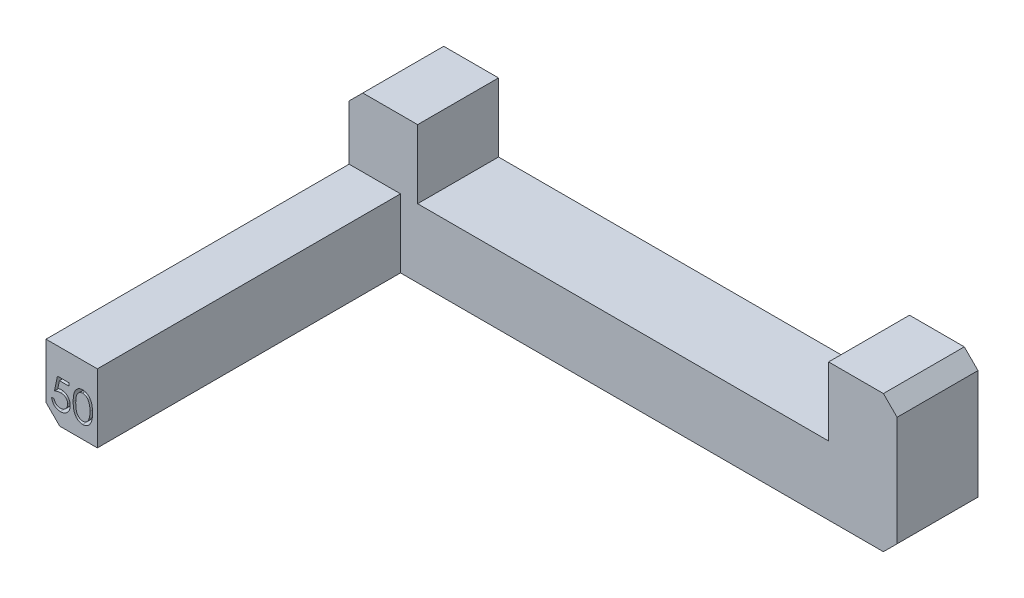
from build123d import *

# Parameters (mm, degrees)
BOSS_EXTRUDE1_DEPTH = 15
SKETCH2_W           = 9.525
SKETCH2_H           = 12.7
BOSS_EXTRUDE2_DEPTH = 56.2
CUT_EXTRUDE1_DEPTH  = 2
CHAMFER1_SIZE       = 2.54


with BuildPart() as part:
    # Sketch1 → Boss-Extrude1 (new body)
    with BuildSketch(Plane.XY):
        Polygon((-101.6, 0), (0, 0), (0, 25.4), (-12.7, 25.4), (-12.7, 12.7), (-88.9, 12.7), (-88.9, 25.4), (-101.6, 25.4), align=None)
    extrude(amount=BOSS_EXTRUDE1_DEPTH)

    # Sketch2 → Boss-Extrude2 (add)
    with BuildSketch(Plane.XY.offset(15)):
        with Locations((-96.8375, 6.35)):
            Rectangle(SKETCH2_W, SKETCH2_H)
    extrude(amount=BOSS_EXTRUDE2_DEPTH)

    # Sketch3 → Cut-Extrude1 (cut)
    # profile 1 of 2: a face of its own
    with BuildSketch(Plane.XY.offset(71.2)):
        with BuildLine():
            Line((-97.310222222, 7.831666667), (-97.310222222, 7.288931624))
            Line((-97.310222222, 7.288931624), (-99.11015211, 7.288931624))
            Line((-99.11015211, 7.288931624), (-99.395300013, 5.897113048))
            add(Edge.make_bspline(
                [(-99.395300013, 5.897113048), (-99.33927506, 5.912580244), (-99.230735575, 5.942545491), (-99.070534357, 5.975816121), (-98.918448525, 5.995872209), (-98.819758382, 5.998610738), (-98.772002738, 5.999935897)],
                knots=[0, 0, 0, 0, 1.100273476, 2.13160584, 3.095893838, 4, 4, 4, 4], degree=3))
            add(Edge.make_bspline(
                [(-98.772002738, 5.999935897), (-98.712911846, 5.998656923), (-98.596724388, 5.99614214), (-98.426727408, 5.971994225), (-98.264450296, 5.933985069), (-98.110232427, 5.880886184), (-97.963788499, 5.812986945), (-97.826465876, 5.728169178), (-97.696203317, 5.629089023), (-97.575337729, 5.51517454), (-97.465687882, 5.389804953), (-97.369279779, 5.255006743), (-97.2873911, 5.112089921), (-97.221531388, 4.959689), (-97.168940787, 4.799488852), (-97.133937176, 4.629803876), (-97.11062858, 4.452233504), (-97.108024496, 4.330820642), (-97.106696581, 4.268907919)],
                knots=[0, 0, 0, 0, 1.052922333, 2.070308379, 3.05430497, 4.020497103, 4.973039431, 5.925935799, 6.892292201, 7.88610001, 8.88166317, 9.857072816, 10.836096531, 11.812156883, 12.81219415, 13.836441305, 14.89672472, 16, 16, 16, 16], degree=3))
            add(Edge.make_bspline(
                [(-97.106696581, 4.268907919), (-97.107702112, 4.225785039), (-97.109699584, 4.140122045), (-97.119857448, 4.012904028), (-97.139415019, 3.888379268), (-97.165673364, 3.766531247), (-97.199755353, 3.647590649), (-97.241013804, 3.531217029), (-97.291505417, 3.418134707), (-97.346888567, 3.307273693), (-97.409249314, 3.201140236), (-97.478462057, 3.101885221), (-97.551586073, 3.0080197), (-97.630267692, 2.920550365), (-97.715238244, 2.840051993), (-97.80546867, 2.766046853), (-97.900238972, 2.697283413), (-98.00101535, 2.636552928), (-98.105552199, 2.580668458), (-98.215359146, 2.534822158), (-98.327936634, 2.493833621), (-98.444904958, 2.461162074), (-98.565999175, 2.435561664), (-98.691418895, 2.418173851), (-98.820506336, 2.405509475), (-98.908007843, 2.404716697), (-98.952207732, 2.404316239)],
                knots=[0, 0, 0, 0, 1.056347294, 2.098418968, 3.122841568, 4.141288669, 5.149314143, 6.15115421, 7.162517403, 8.180376062, 9.185164535, 10.17417709, 11.141909838, 12.097768115, 13.052685741, 14.0056014, 14.954263652, 15.917497458, 16.885230207, 17.854509472, 18.828990115, 19.81800267, 20.826176721, 21.857883937, 22.917946725, 24, 24, 24, 24], degree=3))
            add(Edge.make_bspline(
                [(-98.952207732, 2.404316239), (-99.004934172, 2.405360721), (-99.108667214, 2.407415614), (-99.260644738, 2.42891261), (-99.406868011, 2.459700912), (-99.546159949, 2.506020034), (-99.679768884, 2.564057968), (-99.805896088, 2.637409798), (-99.927764345, 2.720532967), (-100.040419448, 2.818625882), (-100.144976905, 2.925843639), (-100.238573651, 3.042196263), (-100.321930368, 3.165763396), (-100.3937122, 3.297145129), (-100.454941351, 3.435996241), (-100.503042583, 3.582836969), (-100.54186581, 3.73690007), (-100.558290268, 3.842965496), (-100.566632479, 3.896837607)],
                knots=[0, 0, 0, 0, 1.0467383, 2.05933395, 3.04377827, 4.011590433, 4.970194871, 5.932262533, 6.905835911, 7.896367577, 8.894135286, 9.877477877, 10.858688626, 11.851381753, 12.8477658, 13.868841284, 14.917554742, 16, 16, 16, 16], degree=3))
            Line((-100.566632479, 3.896837607), (-100.091739316, 3.896837607))
            add(Edge.make_bspline(
                [(-100.091739316, 3.896837607), (-100.080054474, 3.846375589), (-100.057595557, 3.74938479), (-100.00829877, 3.613114786), (-99.948025363, 3.491679769), (-99.876354503, 3.383473375), (-99.790856243, 3.289116915), (-99.693293892, 3.205029214), (-99.583911025, 3.129169197), (-99.462364118, 3.065937157), (-99.33413482, 3.012009398), (-99.199927252, 2.976099098), (-99.063395681, 2.950848938), (-98.971051002, 2.948321395), (-98.924646968, 2.947051282)],
                knots=[0, 0, 0, 0, 1.136247022, 2.183929868, 3.172523383, 4.106158343, 5.02341133, 5.958108904, 6.928429099, 7.938127109, 8.96079061, 9.975095812, 10.982467395, 12, 12, 12, 12], degree=3))
            add(Edge.make_bspline(
                [(-98.924646968, 2.947051282), (-98.879352654, 2.94829222), (-98.790167777, 2.950735637), (-98.658917228, 2.969542239), (-98.532200145, 2.998506662), (-98.411266879, 3.041852752), (-98.294001218, 3.094534648), (-98.183369446, 3.162139584), (-98.076171049, 3.239942231), (-97.975738037, 3.329079041), (-97.883754584, 3.427307031), (-97.802480449, 3.532350233), (-97.73478202, 3.644407847), (-97.677731641, 3.761539875), (-97.634410582, 3.885030075), (-97.603505765, 4.014299709), (-97.585358284, 4.149668072), (-97.582861857, 4.241999052), (-97.581589744, 4.289048478)],
                knots=[0, 0, 0, 0, 1.027316725, 2.022795036, 3.002884548, 3.971462791, 4.93288096, 5.914575861, 6.907176829, 7.935150275, 8.956128384, 9.956726525, 10.942570165, 11.921478529, 12.907843606, 13.90538589, 14.932640048, 16, 16, 16, 16], degree=3))
            add(Edge.make_bspline(
                [(-97.581589744, 4.289048478), (-97.582585302, 4.33149634), (-97.584533965, 4.414581991), (-97.600455185, 4.536137935), (-97.628148703, 4.651153129), (-97.666587188, 4.760182983), (-97.715390729, 4.863330331), (-97.775029797, 4.960701624), (-97.846623624, 5.051013491), (-97.928405408, 5.134308185), (-98.017997923, 5.211180793), (-98.116942629, 5.276712924), (-98.223168947, 5.331842895), (-98.335397032, 5.379419511), (-98.456296342, 5.413589686), (-98.58347268, 5.439243513), (-98.718299369, 5.454083406), (-98.810481243, 5.456142452), (-98.857865118, 5.457200855)],
                knots=[0, 0, 0, 0, 1.045622112, 2.046656509, 3.013763289, 3.955457236, 4.890082067, 5.820317437, 6.762574623, 7.722996705, 8.69280354, 9.665887285, 10.63943826, 11.638615906, 12.663482002, 13.728887084, 14.832589034, 16, 16, 16, 16], degree=3))
            add(Edge.make_bspline(
                [(-98.857865118, 5.457200855), (-98.898881474, 5.456323056), (-98.983569845, 5.454510625), (-99.113476976, 5.441165802), (-99.249989462, 5.419637345), (-99.392583996, 5.390024804), (-99.541688812, 5.351273057), (-99.696989252, 5.304835658), (-99.858811845, 5.249315493), (-99.967846976, 5.207387027), (-100.023897436, 5.185833333)],
                knots=[0, 0, 0, 0, 0.817624296, 1.688186739, 2.600797293, 3.572016777, 4.590301741, 5.671205678, 6.80286297, 8, 8, 8, 8], degree=3))
            Line((-100.023897436, 5.185833333), (-99.481162393, 7.831666667))
            Line((-99.481162393, 7.831666667), (-97.310222222, 7.831666667))
        make_face()
    # profile 2 of 2: a face of its own
    with BuildSketch(Plane.XY.offset(71.2)):
        with BuildLine():
            add(Edge.make_bspline(
                [(-96.563961538, 5.183713275), (-96.563465606, 5.268527182), (-96.562502251, 5.43327942), (-96.551785233, 5.673346677), (-96.533982037, 5.898560447), (-96.509583866, 6.108931511), (-96.479893111, 6.304514179), (-96.440257792, 6.484785776), (-96.395183673, 6.650580657), (-96.342943666, 6.802439469), (-96.283997842, 6.942408139), (-96.219841281, 7.073074812), (-96.147927842, 7.194241781), (-96.072367509, 7.307842965), (-95.990101639, 7.412018789), (-95.903471325, 7.508240433), (-95.809095393, 7.594284068), (-95.710182035, 7.672670739), (-95.605835714, 7.741386012), (-95.499030731, 7.8019117), (-95.38903194, 7.853618642), (-95.27553902, 7.89427442), (-95.159572058, 7.927855105), (-95.040725659, 7.950819348), (-94.918803597, 7.965268483), (-94.836508452, 7.966649862), (-94.794772503, 7.967350427)],
                knots=[0, 0, 0, 0, 1.646270934, 3.197905019, 4.663502075, 6.030701355, 7.308322542, 8.50163776, 9.611534131, 10.641858119, 11.616356847, 12.558055219, 13.465016945, 14.349605745, 15.204443733, 16.039544428, 16.859896111, 17.680448484, 18.487036065, 19.28249412, 20.06191084, 20.843045899, 21.620316918, 22.403196591, 23.190181807, 24, 24, 24, 24], degree=3))
            add(Edge.make_bspline(
                [(-94.794772503, 7.967350427), (-94.75268791, 7.966612897), (-94.668994897, 7.965146182), (-94.545260044, 7.951049269), (-94.424383739, 7.927658404), (-94.306881315, 7.894515978), (-94.191787586, 7.853398705), (-94.080002779, 7.801862231), (-93.970832548, 7.741871562), (-93.866011756, 7.6713807), (-93.764389659, 7.592788449), (-93.668462382, 7.50394489), (-93.578221193, 7.4057471), (-93.492533529, 7.299245711), (-93.413830423, 7.182398023), (-93.338880115, 7.057236333), (-93.271793823, 6.921571812), (-93.207183064, 6.777668009), (-93.151413453, 6.621543192), (-93.101118058, 6.454077423), (-93.060479618, 6.27329264), (-93.02662917, 6.080137365), (-93.000405339, 5.873902241), (-92.981305988, 5.655029359), (-92.971216919, 5.423374721), (-92.969316906, 5.26499083), (-92.96834188, 5.183713275)],
                knots=[0, 0, 0, 0, 0.810914788, 1.612654377, 2.396697861, 3.181598691, 3.963628158, 4.749916497, 5.551656086, 6.361998678, 7.18212741, 8.025565596, 8.878627764, 9.750805457, 10.657531673, 11.591944965, 12.560506719, 13.57287815, 14.630710178, 15.753379473, 16.941251878, 18.199788006, 19.531962791, 20.947069417, 22.433333509, 24, 24, 24, 24], degree=3))
            add(Edge.make_bspline(
                [(-92.96834188, 5.183713275), (-92.969327014, 5.102790223), (-92.971246507, 4.945114958), (-92.981192885, 4.71450265), (-93.000785101, 4.496791323), (-93.02529306, 4.291458838), (-93.059236778, 4.099359819), (-93.10097316, 3.919829522), (-93.147313529, 3.752092651), (-93.204516134, 3.597523353), (-93.267125185, 3.453965391), (-93.33524435, 3.319909107), (-93.40822373, 3.194169593), (-93.487732904, 3.077753309), (-93.572480326, 2.969835578), (-93.664279841, 2.872321315), (-93.760543701, 2.782860894), (-93.862464854, 2.703256648), (-93.968920413, 2.633580812), (-94.077715684, 2.571269396), (-94.190781038, 2.521024726), (-94.305554193, 2.477882461), (-94.423676841, 2.444922254), (-94.545001742, 2.42213202), (-94.668911765, 2.406148392), (-94.752673655, 2.404929072), (-94.794772503, 2.404316239)],
                knots=[0, 0, 0, 0, 1.561518951, 3.042555995, 4.452378317, 5.7783523, 7.031515105, 8.214008947, 9.334062868, 10.386615937, 11.391082383, 12.354592575, 13.286541444, 14.194233754, 15.072674879, 15.931287219, 16.775624067, 17.606195743, 18.42308326, 19.229000347, 20.022332153, 20.807536673, 21.593273796, 22.3848459, 23.188221202, 24, 24, 24, 24], degree=3))
            add(Edge.make_bspline(
                [(-94.794772503, 2.404316239), (-94.836507294, 2.405021324), (-94.918800156, 2.406411614), (-95.040738943, 2.42079547), (-95.159094542, 2.443920815), (-95.274450991, 2.47630068), (-95.387400127, 2.515935016), (-95.496402846, 2.567572133), (-95.60267113, 2.627041499), (-95.705921459, 2.69476791), (-95.804213654, 2.772361407), (-95.898100832, 2.858183606), (-95.985224372, 2.954376144), (-96.066314017, 3.059420147), (-96.143381984, 3.172349216), (-96.21427425, 3.294705208), (-96.279846851, 3.426002965), (-96.339784033, 3.567090758), (-96.392925465, 3.720027375), (-96.439866643, 3.886562443), (-96.476929714, 4.068165845), (-96.508653944, 4.263379007), (-96.534242, 4.473040783), (-96.551711039, 4.697264995), (-96.562508027, 4.935911918), (-96.563468193, 5.099605505), (-96.563961538, 5.183713275)],
                knots=[0, 0, 0, 0, 0.810891512, 1.598919785, 2.382837074, 3.152667961, 3.926044502, 4.706494248, 5.493654104, 6.291793342, 7.103789334, 7.925228297, 8.761435821, 9.622817696, 10.50288917, 11.416980706, 12.369136599, 13.353924996, 14.394355917, 15.514179734, 16.714354668, 17.994756427, 19.357759367, 20.818452758, 22.365282078, 24, 24, 24, 24], degree=3))
        make_face()
        with BuildLine():
            add(Edge.make_bspline(
                [(-96.089068376, 5.185833333), (-96.088887783, 5.115153753), (-96.088537289, 4.977978566), (-96.07938089, 4.778644112), (-96.066907325, 4.592724686), (-96.050818697, 4.419984221), (-96.026926144, 4.261007416), (-96.000155167, 4.114700871), (-95.967576508, 3.981838858), (-95.929030469, 3.861509668), (-95.88512612, 3.751671195), (-95.837189874, 3.649464596), (-95.785693305, 3.553682502), (-95.72806078, 3.465185261), (-95.665293958, 3.383684275), (-95.598810578, 3.307737016), (-95.526129409, 3.240008247), (-95.425582084, 3.158778359), (-95.292842176, 3.074838716), (-95.125594583, 3.001744033), (-94.953738711, 2.955808652), (-94.837093368, 2.949967021), (-94.778872062, 2.947051282)],
                knots=[0, 0, 0, 0, 1.459021318, 2.831673884, 4.118529203, 5.306027144, 6.411944654, 7.436330062, 8.375795394, 9.233974572, 10.042671642, 10.816086306, 11.563610507, 12.285937304, 12.993564865, 13.685989202, 14.367179055, 15.041617293, 16.353048772, 17.594441528, 18.799311195, 20, 20, 20, 20], degree=3))
            add(Edge.make_bspline(
                [(-94.778872062, 2.947051282), (-94.720274154, 2.949466974), (-94.60319932, 2.954293372), (-94.432151796, 3.000858129), (-94.266098888, 3.071115647), (-94.135966311, 3.154191043), (-94.036962942, 3.233306493), (-93.966028921, 3.300759592), (-93.900923205, 3.376288106), (-93.839173878, 3.457778708), (-93.782539323, 3.546788297), (-93.731039103, 3.642888858), (-93.684044042, 3.746347257), (-93.657269651, 3.818570554), (-93.643580596, 3.855496461)],
                knots=[0, 0, 0, 0, 1.353760809, 2.704726607, 4.075137775, 5.516104923, 6.260822281, 7.007110065, 7.778089737, 8.566572457, 9.372053459, 10.217411131, 11.088608312, 12, 12, 12, 12], degree=3))
            add(Edge.make_bspline(
                [(-93.643580596, 3.855496461), (-93.627627328, 3.902712853), (-93.595235352, 3.998582377), (-93.553488979, 4.147298851), (-93.520612006, 4.303331602), (-93.491034061, 4.465748147), (-93.470845512, 4.635746266), (-93.454595842, 4.812799966), (-93.445024446, 4.99704274), (-93.443837977, 5.122220881), (-93.443235043, 5.185833333)],
                knots=[0, 0, 0, 0, 0.884706709, 1.796334032, 2.740027952, 3.714592787, 4.726048262, 5.777819803, 6.87074269, 8, 8, 8, 8], degree=3))
            add(Edge.make_bspline(
                [(-93.443235043, 5.185833333), (-93.444066876, 5.249435497), (-93.445694121, 5.373854924), (-93.451914079, 5.556066935), (-93.467975911, 5.729131288), (-93.485815055, 5.893793551), (-93.512117997, 6.049142222), (-93.540478014, 6.196477803), (-93.578579847, 6.333974995), (-93.619279983, 6.463786506), (-93.665862367, 6.584437495), (-93.717139727, 6.696490482), (-93.771903577, 6.800486435), (-93.831385297, 6.896140025), (-93.894878771, 6.983879703), (-93.964059827, 7.061946292), (-94.036184296, 7.132759327), (-94.137205517, 7.21358964), (-94.269458312, 7.296006132), (-94.434022565, 7.371851984), (-94.605276991, 7.415407378), (-94.721048761, 7.421548262), (-94.778872062, 7.424615385)],
                knots=[0, 0, 0, 0, 1.31362396, 2.569729283, 3.763502607, 4.902122613, 5.988968491, 7.01645872, 7.998833611, 8.933434873, 9.825090667, 10.667526885, 11.477055099, 12.250526234, 12.991942729, 13.710640831, 14.402115721, 15.076753259, 16.378508321, 17.609869233, 18.806226677, 20, 20, 20, 20], degree=3))
            add(Edge.make_bspline(
                [(-94.778872062, 7.424615385), (-94.83739879, 7.421544031), (-94.954558869, 7.415395728), (-95.127593277, 7.372014261), (-95.293455809, 7.29639942), (-95.425358877, 7.213316666), (-95.526450555, 7.134186124), (-95.597635103, 7.065566128), (-95.664379911, 6.990505719), (-95.7258656, 6.908255205), (-95.783452969, 6.819861138), (-95.836340929, 6.724628125), (-95.883992129, 6.622073562), (-95.927965178, 6.512284428), (-95.966628798, 6.391965619), (-95.998520862, 6.259267259), (-96.02798343, 6.113426066), (-96.048840563, 5.953588238), (-96.067382193, 5.780804506), (-96.079298041, 5.594420942), (-96.088567918, 5.394752176), (-96.088898216, 5.256867734), (-96.089068376, 5.185833333)],
                knots=[0, 0, 0, 0, 1.207732386, 2.417664972, 3.655092373, 4.956220595, 5.625982001, 6.301752483, 6.994047911, 7.697131622, 8.419323945, 9.170223765, 9.943494443, 10.752040957, 11.610060368, 12.549350801, 13.567764191, 14.679664412, 15.874934091, 17.154273443, 18.533957287, 20, 20, 20, 20], degree=3))
        make_face(mode=Mode.SUBTRACT)
    extrude(amount=-CUT_EXTRUDE1_DEPTH, mode=Mode.SUBTRACT)

    # Chamfer1
    chamfer1_edges = [part.edges().sort_by_distance(p)[0] for p in [
        (0, 25.4, 7.5),
        (0, 0, 7.5),
        (-101.6, 0, 35.6),
        (-101.6, 25.4, 7.5),
    ]]
    chamfer(chamfer1_edges, length=CHAMFER1_SIZE)


solid = part.part
